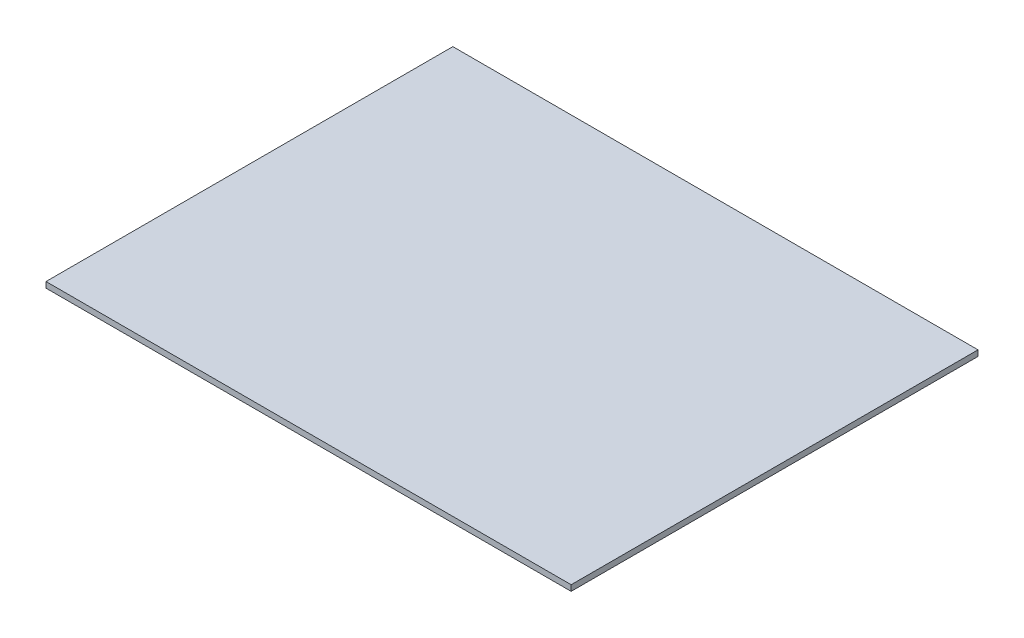
from build123d import *

# Parameters (mm, degrees)
SKETCH1_W           = 182
SKETCH1_H           = 141
BOSS_EXTRUDE1_DEPTH = 2


with BuildPart() as part:
    # Sketch1 → Boss-Extrude1 (new body)
    with BuildSketch(Plane(origin=(0, 0, 0), x_dir=(1, 0, 0), z_dir=(0, 1, 0))):
        Rectangle(SKETCH1_W, SKETCH1_H)
    extrude(amount=BOSS_EXTRUDE1_DEPTH)


solid = part.part
